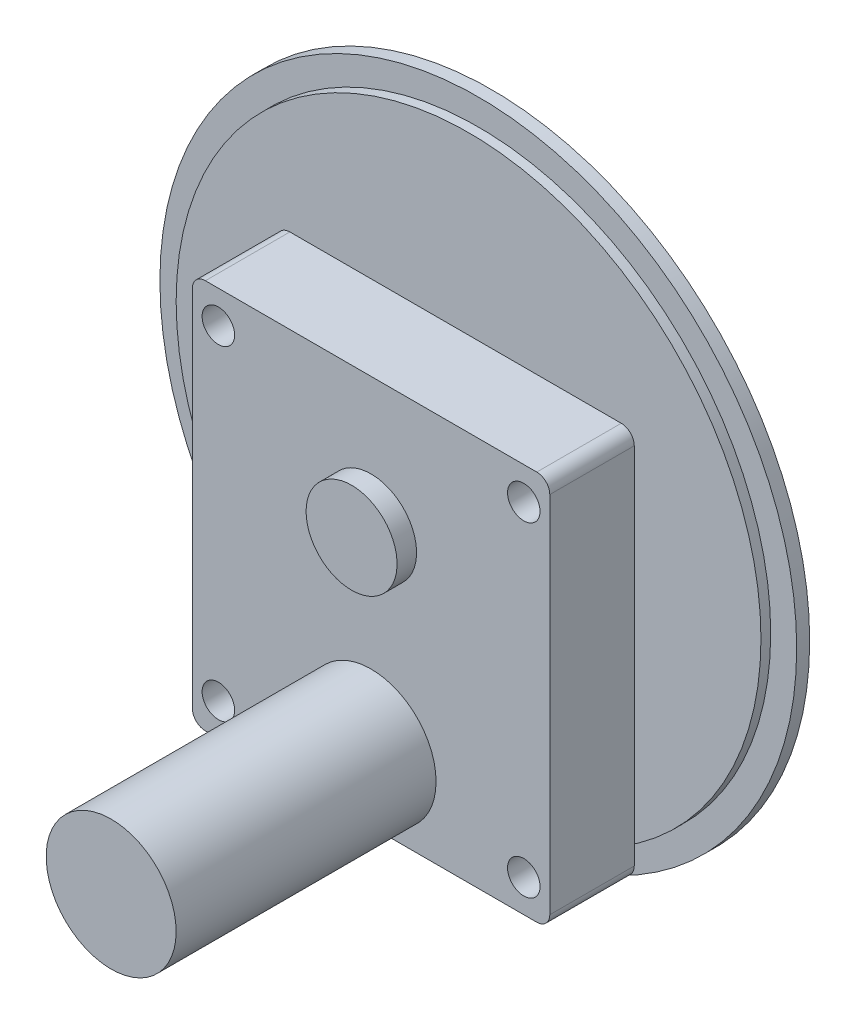
from build123d import *

# Parameters (mm, degrees)
SKETCH1_R           = 57.15
BOSS_EXTRUDE1_DEPTH = 6.35
SKETCH1_5_R         = 62.23
SKETCH1_5_R_2       = 57.15
BOSS_EXTRUDE2_DEPTH = 4.445
SKETCH1_6_R         = 62.23
SKETCH1_6_R_2       = 57.15
CUT_EXTRUDE1_DEPTH  = 1.905
SKETCH1_12_R        = 12.7
BOSS_EXTRUDE5_DEPTH = 69.85
SKETCH1_13_R        = 12.7
CUT_EXTRUDE3_DEPTH  = 3.81
SKETCH1_17_W        = 69.85
SKETCH1_17_H        = 76.2
SKETCH1_17_R        = 3.175
SKETCH1_17_R_2      = 12.7
SKETCH1_17_R_3      = 8.89
BOSS_EXTRUDE8_DEPTH = 19.05
SKETCH1_18_R        = 8.89
BOSS_EXTRUDE9_DEPTH = 22.86
SKETCH1_22_W        = 69.85
SKETCH1_22_H        = 76.2
SKETCH1_22_R        = 3.175
SKETCH1_22_R_2      = 12.7
SKETCH1_22_R_3      = 8.89
CUT_EXTRUDE6_DEPTH  = 2.54
FILLET1_R           = 2.54


with BuildPart() as part:
    # Sketch1 → Boss-Extrude1 (new body)
    with BuildSketch(Plane.XY):
        Circle(SKETCH1_R)
    extrude(amount=-BOSS_EXTRUDE1_DEPTH)

    # Sketch1<5> → Boss-Extrude2 (add)
    with BuildSketch(Plane.XY):
        Circle(SKETCH1_5_R)
        Circle(SKETCH1_5_R_2, mode=Mode.SUBTRACT)
    extrude(amount=-BOSS_EXTRUDE2_DEPTH)

    # Sketch1<6> → Cut-Extrude1 (cut)
    with BuildSketch(Plane.XY):
        Circle(SKETCH1_6_R)
        Circle(SKETCH1_6_R_2, mode=Mode.SUBTRACT)
    extrude(amount=-CUT_EXTRUDE1_DEPTH, mode=Mode.SUBTRACT)

    # Sketch1<12> → Boss-Extrude5 (add)
    with BuildSketch(Plane.XY):
        with Locations((0, -36.83)):
            Circle(SKETCH1_12_R)
    extrude(amount=BOSS_EXTRUDE5_DEPTH)

    # Sketch1<13> → Cut-Extrude3 (cut)
    with BuildSketch(Plane.XY):
        with Locations((0, -36.83)):
            Circle(SKETCH1_13_R)
    extrude(amount=CUT_EXTRUDE3_DEPTH, mode=Mode.SUBTRACT)


with BuildPart() as cut_extrude3_piece_1:
    # of the separate pieces the step leaves, piece 1, a body of its own (cut_extrude3_pieces)
    add(part.part.solids().sort_by_distance((57.15, 0, -4.445))[0])



with BuildPart() as cut_extrude3_piece_2:
    # of the separate pieces the step leaves, piece 2, a body of its own (cut_extrude3_pieces)
    add(part.part.solids().sort_by_distance((12.7, -36.83, 3.81))[0])


with BuildPart() as cut_extrude3_piece_1_1:
    add(cut_extrude3_piece_1.part)

    add(cut_extrude3_piece_2.part)  # Boss-Extrude8 merges Cut-Extrude3 piece 2
    # Sketch1<17> → Boss-Extrude8 (add)
    with BuildSketch(Plane.XY):
        with Locations((0, -12.7)):
            Rectangle(SKETCH1_17_W, SKETCH1_17_H)
        with Locations((29.845, 19.05)):
            Circle(SKETCH1_17_R, mode=Mode.SUBTRACT)
        with Locations((-29.845, -44.45)):
            Circle(SKETCH1_17_R, mode=Mode.SUBTRACT)
        with Locations((0, -36.83)):
            Circle(SKETCH1_17_R_2, mode=Mode.SUBTRACT)
        Circle(SKETCH1_17_R_3, mode=Mode.SUBTRACT)
        with Locations((29.845, -44.45)):
            Circle(SKETCH1_17_R, mode=Mode.SUBTRACT)
        with Locations((-29.845, 19.05)):
            Circle(SKETCH1_17_R, mode=Mode.SUBTRACT)
    extrude(amount=BOSS_EXTRUDE8_DEPTH)

    # Sketch1<18> → Boss-Extrude9 (add)
    with BuildSketch(Plane.XY):
        Circle(SKETCH1_18_R)
    extrude(amount=BOSS_EXTRUDE9_DEPTH)

    # Sketch1<22> → Cut-Extrude6 (cut)
    with BuildSketch(Plane.XY):
        with Locations((0, -12.7)):
            Rectangle(SKETCH1_22_W, SKETCH1_22_H)
        with Locations((29.845, 19.05)):
            Circle(SKETCH1_22_R, mode=Mode.SUBTRACT)
        with Locations((-29.845, -44.45)):
            Circle(SKETCH1_22_R, mode=Mode.SUBTRACT)
        with Locations((0, -36.83)):
            Circle(SKETCH1_22_R_2, mode=Mode.SUBTRACT)
        Circle(SKETCH1_22_R_3, mode=Mode.SUBTRACT)
        with Locations((29.845, -44.45)):
            Circle(SKETCH1_22_R, mode=Mode.SUBTRACT)
        with Locations((-29.845, 19.05)):
            Circle(SKETCH1_22_R, mode=Mode.SUBTRACT)
    extrude(amount=CUT_EXTRUDE6_DEPTH, mode=Mode.SUBTRACT)

    # Fillet1
    fillet1_edges = [cut_extrude3_piece_1_1.edges().sort_by_distance(p)[0] for p in [
        (-34.925, -50.8, 10.795),
        (34.925, -50.8, 10.795),
        (34.925, 25.4, 10.795),
        (-34.925, 25.4, 10.795),
    ]]
    fillet(fillet1_edges, radius=FILLET1_R)


solid = cut_extrude3_piece_1_1.part
